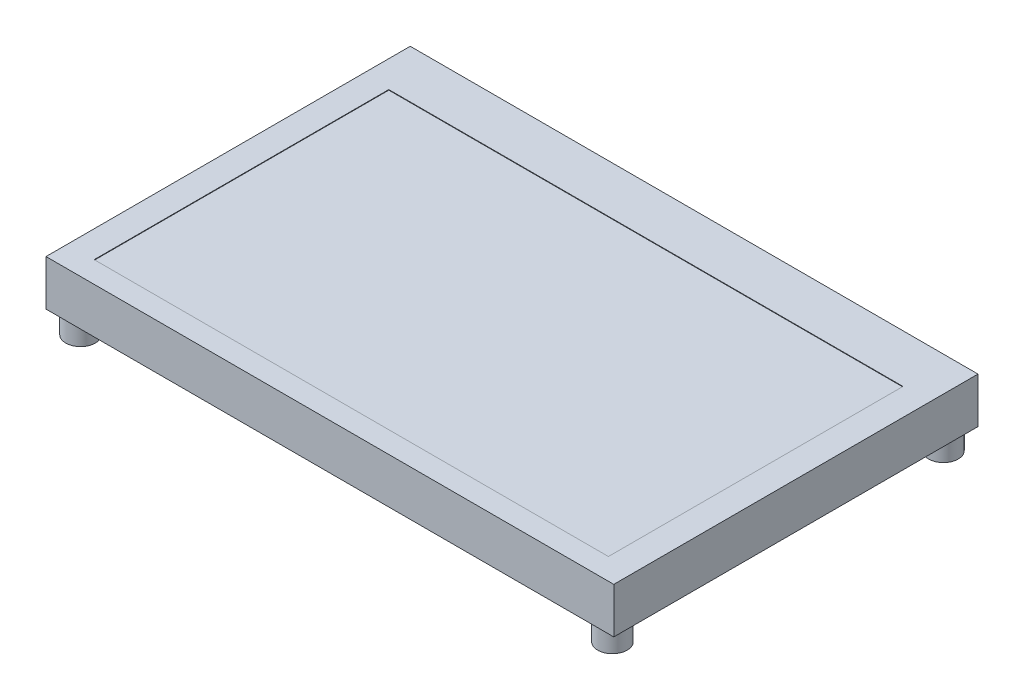
from build123d import *

# Parameters (mm, degrees)
SKETCH1_W           = 106
SKETCH1_H           = 68
BOSS_EXTRUDE1_DEPTH = 8.5
SKETCH2_R           = 2.75
BOSS_EXTRUDE2_DEPTH = 4
SKETCH4_W           = 96
SKETCH4_H           = 55
CUT_EXTRUDE1_DEPTH  = 0.1


with BuildPart() as part:
    # Sketch1 → Boss-Extrude1 (new body)
    with BuildSketch(Plane(origin=(0, 0, 0), x_dir=(1, 0, 0), z_dir=(0, 1, 0))):
        Rectangle(SKETCH1_W, SKETCH1_H)
    extrude(amount=BOSS_EXTRUDE1_DEPTH)

    # Sketch2 → Boss-Extrude2 (add)
    with BuildSketch(Plane(origin=(0, 0, 0), x_dir=(-1, 0, 0), z_dir=(0, -1, 0))):
        with Locations(Location((49.65, -30.9, 0), (0, 0, 90))):
            Circle(SKETCH2_R)
        with Locations(Location((-49.65, -30.9, 0), (0, 0, 90))):
            Circle(SKETCH2_R)
        with Locations(Location((49.65, 30.9, 0), (0, 0, 90))):
            Circle(SKETCH2_R)
        with Locations(Location((-49.65, 30.9, 0), (0, 0, 90))):
            Circle(SKETCH2_R)
        with Locations(Location((27.38, -24.5, 0), (0, 0, 90))):
            Circle(SKETCH2_R)
        with Locations(Location((-30.62, -24.5, 0), (0, 0, 90))):
            Circle(SKETCH2_R)
        with Locations(Location((27.38, 24.54, 0), (0, 0, 90))):
            Circle(SKETCH2_R)
        with Locations(Location((-30.62, 24.54, 0), (0, 0, 90))):
            Circle(SKETCH2_R)
    extrude(amount=BOSS_EXTRUDE2_DEPTH)

    # Sketch4 → Cut-Extrude1 (cut)
    with BuildSketch(Plane(origin=(0, 8.5, 0), x_dir=(1, 0, 0), z_dir=(0, 1, 0))):
        with Locations((0, -2.5)):
            Rectangle(SKETCH4_W, SKETCH4_H)
    extrude(amount=-CUT_EXTRUDE1_DEPTH, mode=Mode.SUBTRACT)


solid = part.part
